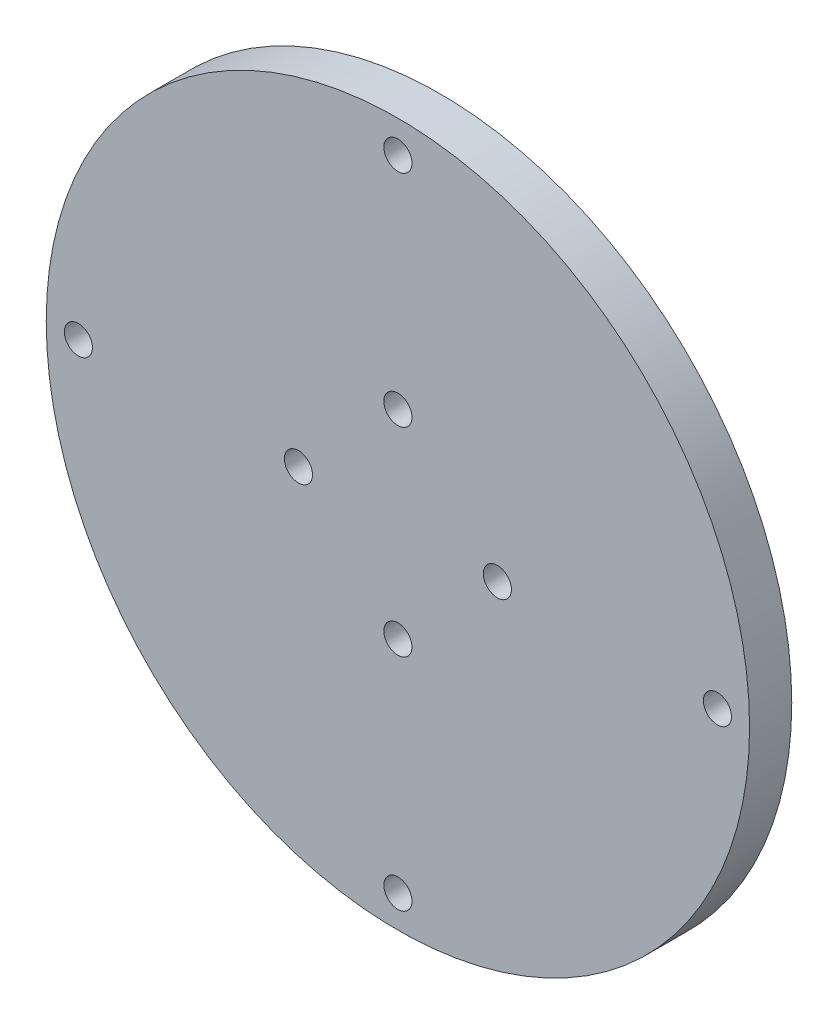
from build123d import *

# Parameters (mm, degrees)
SKETCH1_R           = 25
SKETCH1_R_2         = 1
BOSS_EXTRUDE1_DEPTH = 1.5


with BuildPart() as part:
    # Sketch1 → Boss-Extrude1 (new, symmetric)
    with BuildSketch(Plane.XY):
        Circle(SKETCH1_R)
        with Locations((0, 22.715)):
            Circle(SKETCH1_R_2, mode=Mode.SUBTRACT)
        with Locations((0, 7.071067812)):
            Circle(SKETCH1_R_2, mode=Mode.SUBTRACT)
        with Locations((7.071067812, 0)):
            Circle(SKETCH1_R_2, mode=Mode.SUBTRACT)
        with Locations((0, -7.071067812)):
            Circle(SKETCH1_R_2, mode=Mode.SUBTRACT)
        with Locations((-7.071067812, 0)):
            Circle(SKETCH1_R_2, mode=Mode.SUBTRACT)
        with Locations((22.715, 0)):
            Circle(SKETCH1_R_2, mode=Mode.SUBTRACT)
        with Locations((0, -22.715)):
            Circle(SKETCH1_R_2, mode=Mode.SUBTRACT)
        with Locations((-22.715, 0)):
            Circle(SKETCH1_R_2, mode=Mode.SUBTRACT)
    extrude(amount=BOSS_EXTRUDE1_DEPTH, both=True)


solid = part.part
